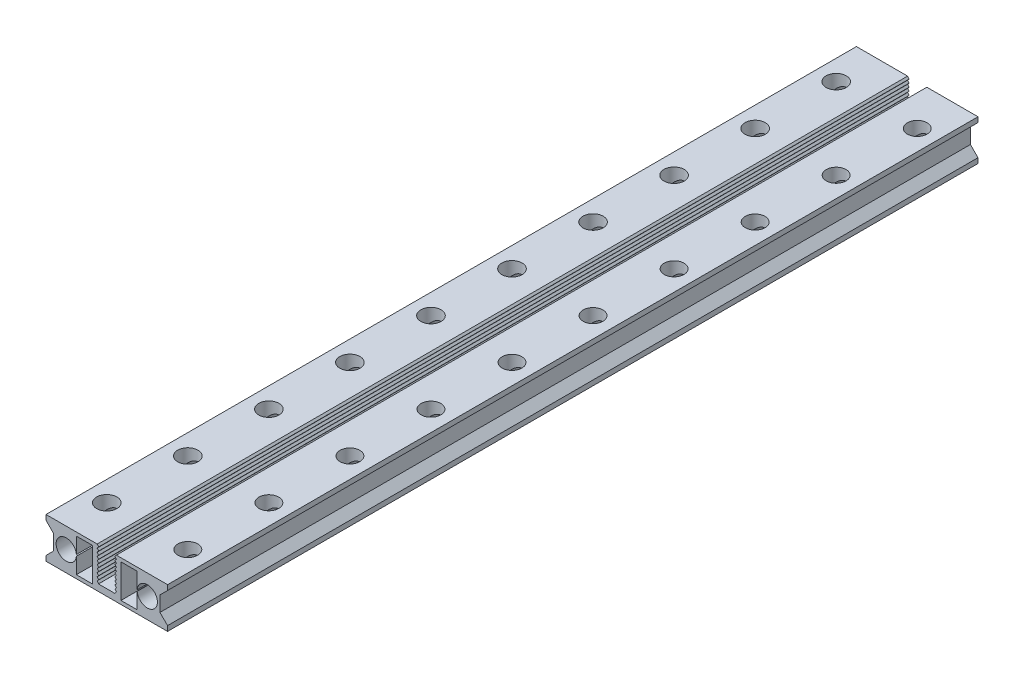
from build123d import *

# Parameters (mm, degrees)
EXTRUDE_2_DEPTH        = 160
EXTRUDE_3_DEPTH        = 160
PATTERN_LINEAR_1_COUNT = 10
PATTERN_LINEAR_1_PITCH = 0.7
MIRROR_1_COPY_1_DEPTH  = 160
MIRROR_1_COPY_2_DEPTH  = 160
MIRROR_1_COPY_3_DEPTH  = 160
MIRROR_1_COPY_4_DEPTH  = 160
MIRROR_1_COPY_5_DEPTH  = 160
MIRROR_1_COPY_6_DEPTH  = 160
MIRROR_1_COPY_7_DEPTH  = 160
MIRROR_1_COPY_8_DEPTH  = 160
MIRROR_1_COPY_9_DEPTH  = 160
SKETCH_4_R             = 2
SKETCH_4_R_2           = 1.95
CUT_EXTRUDE_1_DEPTH    = 161.648685024
PATTERN_LINEAR_2_COUNT = 10
PATTERN_LINEAR_2_PITCH = 16


with BuildPart() as part:
    # 草图1 → 凸台-拉伸2 (new body)
    with BuildSketch(Plane.XY):
        Polygon((-1.9, 8), (-12, 8), (-12, 7), (-10.5, 5.5), (-10.5, 2.5), (-12, 1), (-12, 0), (12, 0), (12, 1), (10.5, 2.5), (10.5, 5.5), (12, 7), (12, 8), (1.9, 8), (1.9, 1.3), (-1.9, 1.3), align=None)
        with BuildLine():
            Line((-6.005, 4.14133294), (-6.005, 7.3))
            Line((-6.005, 7.3), (-2.8, 7.3))
            Line((-2.8, 7.3), (-2.8, 0.7))
            Line((-2.8, 0.7), (-6.005, 0.7))
            Line((-6.005, 0.7), (-6.005, 3.85866706))
            ThreePointArc((-6.005, 3.85866706), (-10, 4), (-6.005, 4.14133294))
        make_face(mode=Mode.SUBTRACT)
        with BuildLine():
            Line((2.8, 0.7), (2.8, 7.3))
            Line((2.8, 7.3), (6.005, 7.3))
            Line((6.005, 7.3), (6.005, 4.14133294))
            ThreePointArc((6.005, 4.14133294), (10, 4), (6.005, 3.85866706))
            Line((6.005, 3.85866706), (6.005, 0.7))
            Line((6.005, 0.7), (2.8, 0.7))
        make_face(mode=Mode.SUBTRACT)
    extrude(amount=EXTRUDE_2_DEPTH)

    # 草图3 → 凸台-拉伸3 (add)
    with BuildSketch(Plane.XY.offset(160)):
        Polygon((-1.9, 8), (-1.6, 7.65), (-1.9, 7.3), align=None)
    extrude_3 = extrude(amount=-EXTRUDE_3_DEPTH)

    # 阵列(线性)1: 凸台-拉伸3 ×10
    with Locations(*[(0, -i * PATTERN_LINEAR_1_PITCH, 0) for i in range(1, PATTERN_LINEAR_1_COUNT)]):
        add(extrude_3)

    # 镜向1: 凸台-拉伸3 across plane
    add(extrude_3.mirror(Plane(origin=(0, 0, 0), x_dir=(0, 0, 1), z_dir=(1, 0, 0))))

    # 镜向1 copy 1 sketch → 镜向1 copy 1 (add)
    with BuildSketch(Plane(origin=(0, -0.7, 160), x_dir=(-1, 0, 0), z_dir=(0, 0, 1))):
        Polygon((-1.9, -8), (-1.6, -7.65), (-1.9, -7.3), align=None)
    extrude(amount=-MIRROR_1_COPY_1_DEPTH)

    # 镜向1 copy 2 sketch → 镜向1 copy 2 (add)
    with BuildSketch(Plane(origin=(0, -1.4, 160), x_dir=(-1, 0, 0), z_dir=(0, 0, 1))):
        Polygon((-1.9, -8), (-1.6, -7.65), (-1.9, -7.3), align=None)
    extrude(amount=-MIRROR_1_COPY_2_DEPTH)

    # 镜向1 copy 3 sketch → 镜向1 copy 3 (add)
    with BuildSketch(Plane(origin=(0, -2.1, 160), x_dir=(-1, 0, 0), z_dir=(0, 0, 1))):
        Polygon((-1.9, -8), (-1.6, -7.65), (-1.9, -7.3), align=None)
    extrude(amount=-MIRROR_1_COPY_3_DEPTH)

    # 镜向1 copy 4 sketch → 镜向1 copy 4 (add)
    with BuildSketch(Plane(origin=(0, -2.8, 160), x_dir=(-1, 0, 0), z_dir=(0, 0, 1))):
        Polygon((-1.9, -8), (-1.6, -7.65), (-1.9, -7.3), align=None)
    extrude(amount=-MIRROR_1_COPY_4_DEPTH)

    # 镜向1 copy 5 sketch → 镜向1 copy 5 (add)
    with BuildSketch(Plane(origin=(0, -3.5, 160), x_dir=(-1, 0, 0), z_dir=(0, 0, 1))):
        Polygon((-1.9, -8), (-1.6, -7.65), (-1.9, -7.3), align=None)
    extrude(amount=-MIRROR_1_COPY_5_DEPTH)

    # 镜向1 copy 6 sketch → 镜向1 copy 6 (add)
    with BuildSketch(Plane(origin=(0, -4.2, 160), x_dir=(-1, 0, 0), z_dir=(0, 0, 1))):
        Polygon((-1.9, -8), (-1.6, -7.65), (-1.9, -7.3), align=None)
    extrude(amount=-MIRROR_1_COPY_6_DEPTH)

    # 镜向1 copy 7 sketch → 镜向1 copy 7 (add)
    with BuildSketch(Plane(origin=(0, -4.9, 160), x_dir=(-1, 0, 0), z_dir=(0, 0, 1))):
        Polygon((-1.9, -8), (-1.6, -7.65), (-1.9, -7.3), align=None)
    extrude(amount=-MIRROR_1_COPY_7_DEPTH)

    # 镜向1 copy 8 sketch → 镜向1 copy 8 (add)
    with BuildSketch(Plane(origin=(0, -5.6, 160), x_dir=(-1, 0, 0), z_dir=(0, 0, 1))):
        Polygon((-1.9, -8), (-1.6, -7.65), (-1.9, -7.3), align=None)
    extrude(amount=-MIRROR_1_COPY_8_DEPTH)

    # 镜向1 copy 9 sketch → 镜向1 copy 9 (add)
    with BuildSketch(Plane(origin=(0, -6.3, 160), x_dir=(-1, 0, 0), z_dir=(0, 0, 1))):
        Polygon((-1.9, -8), (-1.6, -7.65), (-1.9, -7.3), align=None)
    extrude(amount=-MIRROR_1_COPY_9_DEPTH)

    # 草图4 → 切除-拉伸1 (cut, through all)
    with BuildSketch(Plane(origin=(0, 8, 0), x_dir=(1, 0, 0), z_dir=(0, 1, 0))):
        with Locations(Location((-8, -8, 0), (0, 0, 180))):
            Circle(SKETCH_4_R)
        with Locations(Location((8, -8, 0), (0, 0, 180))):
            Circle(SKETCH_4_R_2)
    cut_extrude_1 = extrude(amount=-CUT_EXTRUDE_1_DEPTH, mode=Mode.SUBTRACT)

    # 阵列(线性)2: 切除-拉伸1 ×10
    with Locations(*[(0, 0, i * PATTERN_LINEAR_2_PITCH) for i in range(1, PATTERN_LINEAR_2_COUNT)]):
        add(cut_extrude_1, mode=Mode.SUBTRACT)


solid = part.part
